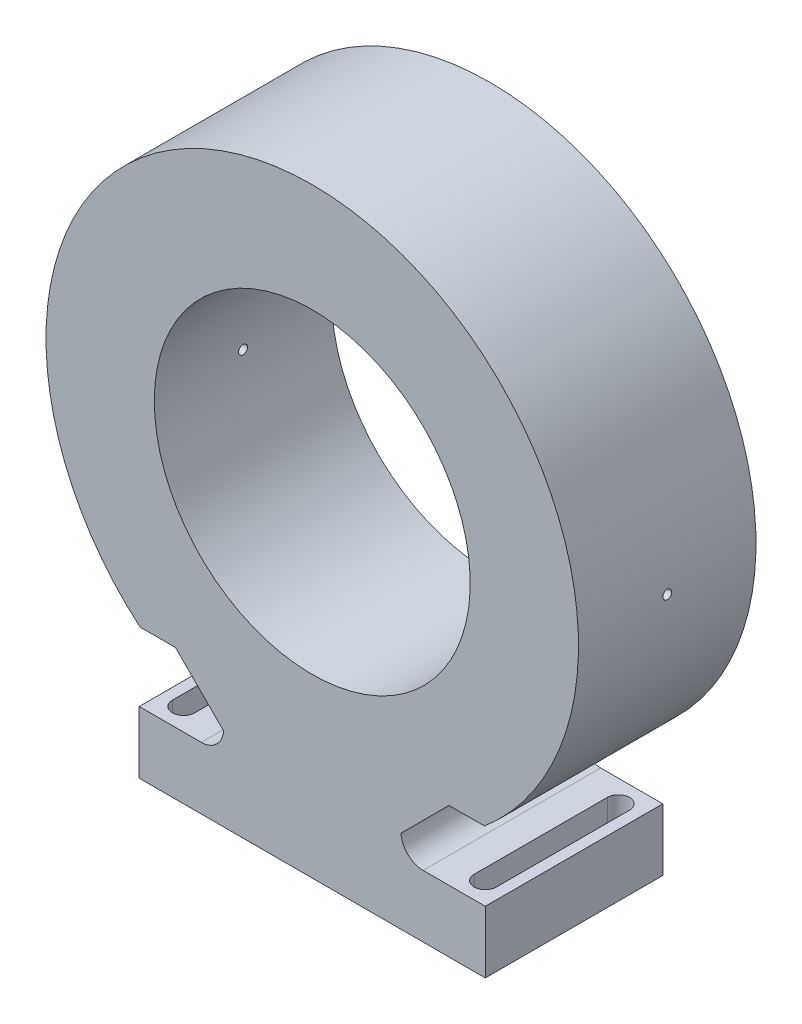
from build123d import *

# Parameters (mm, degrees)
BOSS_EXTRUDE1_DEPTH     = 50.8
CUT_EXTRUDE1_DEPTH      = 25.4
CUT_EXTRUDE2_DEPTH      = 72.136
CUT_EXTRUDE3_DEPTH      = 113.284
CUT_EXTRUDE3_DEPTH_BACK = 90.424
SKETCH5_R               = 1.27


with BuildPart() as part:
    # Sketch2 → Boss-Extrude1 (new body)
    with BuildSketch(Plane.XY):
        with BuildLine():
            Line((31.743188487, -77.898004197), (49.523188487, -77.898004197))
            Line((49.523188487, -77.898004197), (49.523188487, -95.678004197))
            Line((49.523188487, -95.678004197), (-49.523188487, -95.678004197))
            Line((-49.523188487, -95.678004197), (-49.523188487, -77.898004197))
            Line((-49.523188487, -77.898004197), (-31.743188487, -77.898004197))
            ThreePointArc((-31.743188487, -77.898004197), (-27.358253154, -76.140916358), (-25.4, -71.842048969))
            ThreePointArc((-25.4, -71.842048969), (-73.310915254, -20.783399738), (-59.324614565, 47.822903578))
            ThreePointArc((-59.324614565, 47.822903578), (0, 76.2), (59.324614565, 47.822903578))
            ThreePointArc((59.324614565, 47.822903578), (73.310915254, -20.783399738), (25.4, -71.842048969))
            ThreePointArc((25.4, -71.842048969), (27.358253154, -76.140916358), (31.743188487, -77.898004197))
        make_face()
        with BuildLine():
            ThreePointArc((-35.199271309, 28.37492279), (0, -45.212), (35.199271309, 28.37492279))
            ThreePointArc((35.199271309, 28.37492279), (0, 45.212), (-35.199271309, 28.37492279))
        make_face(mode=Mode.SUBTRACT)
    extrude(amount=BOSS_EXTRUDE1_DEPTH)

    # Sketch3 → Cut-Extrude1 (cut)
    with BuildSketch(Plane.XZ.offset(95.678004197)):
        with BuildLine():
            Line((-39.998188487, 44.45), (-39.998188487, 6.35))
            ThreePointArc((-39.998188487, 6.35), (-43.173188487, 3.175), (-46.348188487, 6.35))
            Line((-46.348188487, 6.35), (-46.348188487, 44.45))
            ThreePointArc((-46.348188487, 44.45), (-43.173188487, 47.625), (-39.998188487, 44.45))
        make_face()
        with BuildLine():
            Line((46.348188487, 44.45), (46.348188487, 6.35))
            ThreePointArc((46.348188487, 6.35), (43.173188487, 3.175), (39.998188487, 6.35))
            Line((39.998188487, 6.35), (39.998188487, 44.45))
            ThreePointArc((39.998188487, 44.45), (43.173188487, 47.625), (46.348188487, 44.45))
        make_face()
    extrude(amount=-CUT_EXTRUDE1_DEPTH, mode=Mode.SUBTRACT)

    # Sketch4 → Cut-Extrude2 (cut)
    with BuildSketch(Plane.XY.offset(50.8)):
        with BuildLine():
            Line((25.4, -71.842048969), (39.134215056, -58.107833913))
            Line((39.134215056, -58.107833913), (49.294215056, -58.107833913))
            ThreePointArc((49.294215056, -58.107833913), (40.1915566, -69.92359541), (25.4, -71.842048969))
        make_face()
        with BuildLine():
            Line((-25.400000099, -71.842048964), (-39.134215677, -58.107833386))
            Line((-39.134215677, -58.107833386), (-49.294215677, -58.107833386))
            ThreePointArc((-49.294215677, -58.107833386), (-40.191557069, -69.923595252), (-25.400000099, -71.842048964))
        make_face()
    extrude(amount=-CUT_EXTRUDE2_DEPTH, mode=Mode.SUBTRACT)

    # Sketch5 → Cut-Extrude3 (cut, two sides: drawn at the far end of the back side and taken through both)
    with BuildSketch(Plane(origin=(0, 0, 0), x_dir=(0, 0, -1), z_dir=(1, 0, 0)).offset(-CUT_EXTRUDE3_DEPTH_BACK)):
        with Locations(Location((-25.4, 0, 0), (0, 0, 180))):
            Circle(SKETCH5_R)
    extrude(amount=CUT_EXTRUDE3_DEPTH + CUT_EXTRUDE3_DEPTH_BACK, mode=Mode.SUBTRACT)


solid = part.part
